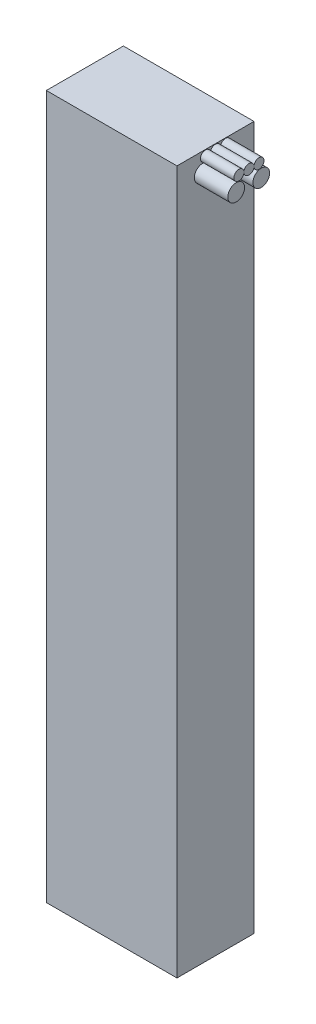
from build123d import *

# Parameters (mm, degrees)
SKETCH1_W           = 19.5
SKETCH1_H           = 11.5
BOSS_EXTRUDE1_DEPTH = 105
SKETCH2_R           = 0.75
SKETCH2_R_2         = 1.25
BOSS_EXTRUDE3_DEPTH = 5


with BuildPart() as part:
    # Sketch1 → Boss-Extrude1 (new body)
    with BuildSketch(Plane(origin=(0, 0, 0), x_dir=(1, 0, 0), z_dir=(0, 1, 0))):
        Rectangle(SKETCH1_W, SKETCH1_H)
    extrude(amount=BOSS_EXTRUDE1_DEPTH)


with BuildPart() as body_2:
    # Sketch2 → Boss-Extrude3 (new body)
    with BuildSketch(Plane(origin=(9.75, 0, 0), x_dir=(0, 0, -1), z_dir=(1, 0, 0))):
        with Locations((-1.5, 104.189461368)):
            Circle(SKETCH2_R)
        with Locations((-1.908718428, 102.158194126)):
            Circle(SKETCH2_R_2)
        with BuildLine():
            ThreePointArc((0.75, 104.189461368), (0.530330086, 104.719791454), (0, 104.939461368))
            Line((0, 104.939461368), (0, 103.439461368))
            ThreePointArc((0, 103.439461368), (0.530330086, 103.659131282), (0.75, 104.189461368))
        make_face()
        with BuildLine():
            Line((0, 103.439461368), (0, 104.939461368))
            ThreePointArc((0, 104.939461368), (-0.530330086, 104.719791454), (-0.75, 104.189461368))
            ThreePointArc((-0.75, 104.189461368), (-0.530330086, 103.659131282), (0, 103.439461368))
        make_face()
        with Locations((1.5, 104.189461368)):
            Circle(SKETCH2_R)
        with Locations((1.836128902, 102.158194126)):
            Circle(SKETCH2_R_2)
    extrude(amount=BOSS_EXTRUDE3_DEPTH)


solid = Compound([part.part, body_2.part])
